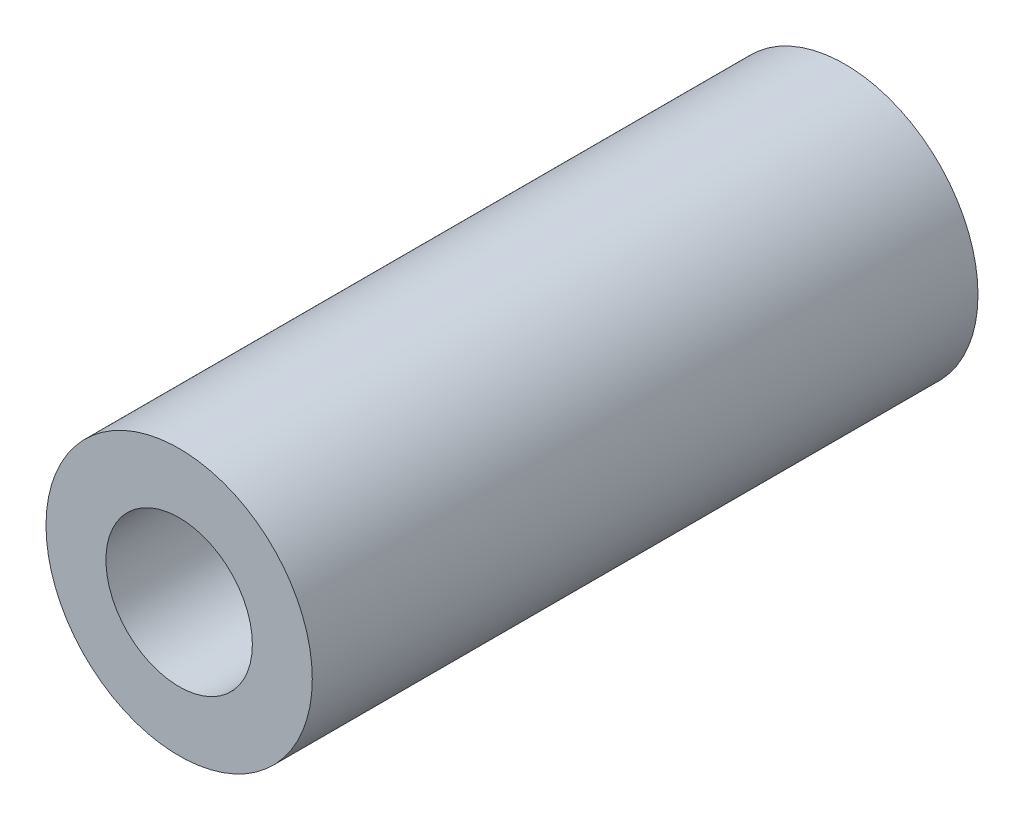
from build123d import *

# Parameters (mm, degrees)
SKETCH_1_R      = 2
SKETCH_1_R_2    = 1.1
F_10MM_M2_DEPTH = 10


with BuildPart() as part:
    # 草图1 → 10mm铝柱_M2简化内孔 (new body)
    with BuildSketch(Plane.XY):
        Circle(SKETCH_1_R)
        Circle(SKETCH_1_R_2, mode=Mode.SUBTRACT)
    extrude(amount=F_10MM_M2_DEPTH)


solid = part.part
